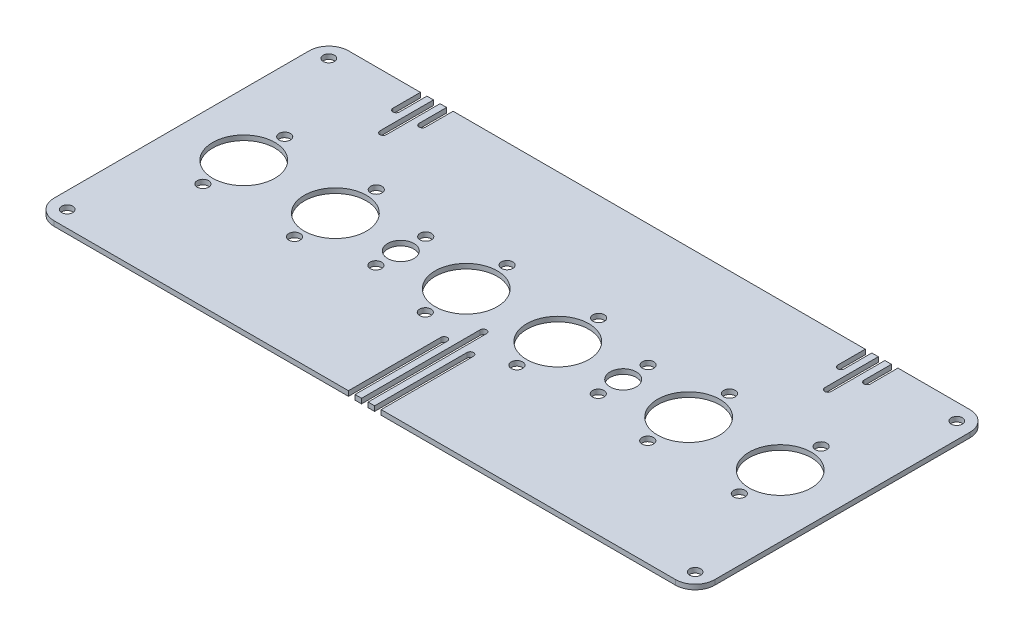
from build123d import *

# Parameters (mm, degrees)
ESQUISSE1_W             = 202
ESQUISSE1_H             = 90
BOSS_EXTRU_1_DEPTH      = 1.5
ENL_V_MAT_EXTRU_1_REACH = 223.148
ESQUISSE2_R             = 9.5
ESQUISSE2_R_2           = 4
ESQUISSE2_R_3           = 1.75
D_GAGEMENT_M31_D        = 3.4
CONG_1_R                = 6
ENL_V_MAT_EXTRU_3_REACH = 223.148


with BuildPart() as part:
    # Esquisse1 → Boss.-Extru.1 (new body)
    with BuildSketch(Plane(origin=(0, 0, 0), x_dir=(1, 0, 0), z_dir=(0, 1, 0))):
        with Locations((101, -45)):
            Rectangle(ESQUISSE1_W, ESQUISSE1_H)
    extrude(amount=BOSS_EXTRU_1_DEPTH)

    # Esquisse2 → Enlèv. mat.-Extru.1 (cut, up to next)
    with BuildSketch(Plane(origin=(0, 1.5, 0), x_dir=(1, 0, 0), z_dir=(0, 1, 0)), mode=Mode.PRIVATE) as enl_v_mat_extru_1_sk1:
        with Locations(Location((115, -45, 0), (0, 0, 270))):
            Circle(ESQUISSE2_R)
    enl_v_mat_extru_1_tool1 = extrude(enl_v_mat_extru_1_sk1.sketch, amount=-ENL_V_MAT_EXTRU_1_REACH, mode=Mode.PRIVATE) & part.part
    # Esquisse2 → Enlèv. mat.-Extru.1 (cut, up to next)
    with BuildSketch(Plane(origin=(0, 1.5, 0), x_dir=(1, 0, 0), z_dir=(0, 1, 0)), mode=Mode.PRIVATE) as enl_v_mat_extru_1_sk2:
        with Locations(Location((87, -45, 0), (0, 0, 270))):
            Circle(ESQUISSE2_R)
    enl_v_mat_extru_1_tool2 = extrude(enl_v_mat_extru_1_sk2.sketch, amount=-ENL_V_MAT_EXTRU_1_REACH, mode=Mode.PRIVATE) & part.part
    # Esquisse2 → Enlèv. mat.-Extru.1 (cut, up to next)
    with BuildSketch(Plane(origin=(0, 1.5, 0), x_dir=(1, 0, 0), z_dir=(0, 1, 0)), mode=Mode.PRIVATE) as enl_v_mat_extru_1_sk3:
        with Locations(Location((155, -45, 0), (0, 0, 270))):
            Circle(ESQUISSE2_R)
    enl_v_mat_extru_1_tool3 = extrude(enl_v_mat_extru_1_sk3.sketch, amount=-ENL_V_MAT_EXTRU_1_REACH, mode=Mode.PRIVATE) & part.part
    # Esquisse2 → Enlèv. mat.-Extru.1 (cut, up to next)
    with BuildSketch(Plane(origin=(0, 1.5, 0), x_dir=(1, 0, 0), z_dir=(0, 1, 0)), mode=Mode.PRIVATE) as enl_v_mat_extru_1_sk4:
        with Locations(Location((183, -45, 0), (0, 0, 270))):
            Circle(ESQUISSE2_R)
    enl_v_mat_extru_1_tool4 = extrude(enl_v_mat_extru_1_sk4.sketch, amount=-ENL_V_MAT_EXTRU_1_REACH, mode=Mode.PRIVATE) & part.part
    # Esquisse2 → Enlèv. mat.-Extru.1 (cut, up to next)
    with BuildSketch(Plane(origin=(0, 1.5, 0), x_dir=(1, 0, 0), z_dir=(0, 1, 0)), mode=Mode.PRIVATE) as enl_v_mat_extru_1_sk5:
        with Locations(Location((47, -45, 0), (0, 0, 270))):
            Circle(ESQUISSE2_R)
    enl_v_mat_extru_1_tool5 = extrude(enl_v_mat_extru_1_sk5.sketch, amount=-ENL_V_MAT_EXTRU_1_REACH, mode=Mode.PRIVATE) & part.part
    # Esquisse2 → Enlèv. mat.-Extru.1 (cut, up to next)
    with BuildSketch(Plane(origin=(0, 1.5, 0), x_dir=(1, 0, 0), z_dir=(0, 1, 0)), mode=Mode.PRIVATE) as enl_v_mat_extru_1_sk6:
        with Locations(Location((19, -45, 0), (0, 0, 270))):
            Circle(ESQUISSE2_R)
    enl_v_mat_extru_1_tool6 = extrude(enl_v_mat_extru_1_sk6.sketch, amount=-ENL_V_MAT_EXTRU_1_REACH, mode=Mode.PRIVATE) & part.part
    # Esquisse2 → Enlèv. mat.-Extru.1 (cut, up to next)
    with BuildSketch(Plane(origin=(0, 1.5, 0), x_dir=(1, 0, 0), z_dir=(0, 1, 0)), mode=Mode.PRIVATE) as enl_v_mat_extru_1_sk7:
        with Locations(Location((67, -45, 0), (0, 0, 270))):
            Circle(ESQUISSE2_R_2)
    enl_v_mat_extru_1_tool7 = extrude(enl_v_mat_extru_1_sk7.sketch, amount=-ENL_V_MAT_EXTRU_1_REACH, mode=Mode.PRIVATE) & part.part
    # Esquisse2 → Enlèv. mat.-Extru.1 (cut, up to next)
    with BuildSketch(Plane(origin=(0, 1.5, 0), x_dir=(1, 0, 0), z_dir=(0, 1, 0)), mode=Mode.PRIVATE) as enl_v_mat_extru_1_sk8:
        with Locations(Location((135, -45, 0), (0, 0, 270))):
            Circle(ESQUISSE2_R_2)
    enl_v_mat_extru_1_tool8 = extrude(enl_v_mat_extru_1_sk8.sketch, amount=-ENL_V_MAT_EXTRU_1_REACH, mode=Mode.PRIVATE) & part.part
    # Esquisse2 → Enlèv. mat.-Extru.1 (cut, up to next)
    with BuildSketch(Plane(origin=(0, 1.5, 0), x_dir=(1, 0, 0), z_dir=(0, 1, 0)), mode=Mode.PRIVATE) as enl_v_mat_extru_1_sk9:
        with Locations(Location((19, -57.5, 0), (0, 0, 270))):
            Circle(ESQUISSE2_R_3)
    enl_v_mat_extru_1_tool9 = extrude(enl_v_mat_extru_1_sk9.sketch, amount=-ENL_V_MAT_EXTRU_1_REACH, mode=Mode.PRIVATE) & part.part
    # Esquisse2 → Enlèv. mat.-Extru.1 (cut, up to next)
    with BuildSketch(Plane(origin=(0, 1.5, 0), x_dir=(1, 0, 0), z_dir=(0, 1, 0)), mode=Mode.PRIVATE) as enl_v_mat_extru_1_sk10:
        with Locations(Location((19, -32.5, 0), (0, 0, 270))):
            Circle(ESQUISSE2_R_3)
    enl_v_mat_extru_1_tool10 = extrude(enl_v_mat_extru_1_sk10.sketch, amount=-ENL_V_MAT_EXTRU_1_REACH, mode=Mode.PRIVATE) & part.part
    # Esquisse2 → Enlèv. mat.-Extru.1 (cut, up to next)
    with BuildSketch(Plane(origin=(0, 1.5, 0), x_dir=(1, 0, 0), z_dir=(0, 1, 0)), mode=Mode.PRIVATE) as enl_v_mat_extru_1_sk11:
        with Locations(Location((47, -57.5, 0), (0, 0, 270))):
            Circle(ESQUISSE2_R_3)
    enl_v_mat_extru_1_tool11 = extrude(enl_v_mat_extru_1_sk11.sketch, amount=-ENL_V_MAT_EXTRU_1_REACH, mode=Mode.PRIVATE) & part.part
    # Esquisse2 → Enlèv. mat.-Extru.1 (cut, up to next)
    with BuildSketch(Plane(origin=(0, 1.5, 0), x_dir=(1, 0, 0), z_dir=(0, 1, 0)), mode=Mode.PRIVATE) as enl_v_mat_extru_1_sk12:
        with Locations(Location((47, -32.5, 0), (0, 0, 270))):
            Circle(ESQUISSE2_R_3)
    enl_v_mat_extru_1_tool12 = extrude(enl_v_mat_extru_1_sk12.sketch, amount=-ENL_V_MAT_EXTRU_1_REACH, mode=Mode.PRIVATE) & part.part
    # Esquisse2 → Enlèv. mat.-Extru.1 (cut, up to next)
    with BuildSketch(Plane(origin=(0, 1.5, 0), x_dir=(1, 0, 0), z_dir=(0, 1, 0)), mode=Mode.PRIVATE) as enl_v_mat_extru_1_sk13:
        with Locations(Location((87, -57.5, 0), (0, 0, 270))):
            Circle(ESQUISSE2_R_3)
    enl_v_mat_extru_1_tool13 = extrude(enl_v_mat_extru_1_sk13.sketch, amount=-ENL_V_MAT_EXTRU_1_REACH, mode=Mode.PRIVATE) & part.part
    # Esquisse2 → Enlèv. mat.-Extru.1 (cut, up to next)
    with BuildSketch(Plane(origin=(0, 1.5, 0), x_dir=(1, 0, 0), z_dir=(0, 1, 0)), mode=Mode.PRIVATE) as enl_v_mat_extru_1_sk14:
        with Locations(Location((87, -32.5, 0), (0, 0, 270))):
            Circle(ESQUISSE2_R_3)
    enl_v_mat_extru_1_tool14 = extrude(enl_v_mat_extru_1_sk14.sketch, amount=-ENL_V_MAT_EXTRU_1_REACH, mode=Mode.PRIVATE) & part.part
    # Esquisse2 → Enlèv. mat.-Extru.1 (cut, up to next)
    with BuildSketch(Plane(origin=(0, 1.5, 0), x_dir=(1, 0, 0), z_dir=(0, 1, 0)), mode=Mode.PRIVATE) as enl_v_mat_extru_1_sk15:
        with Locations(Location((115, -32.5, 0), (0, 0, 270))):
            Circle(ESQUISSE2_R_3)
    enl_v_mat_extru_1_tool15 = extrude(enl_v_mat_extru_1_sk15.sketch, amount=-ENL_V_MAT_EXTRU_1_REACH, mode=Mode.PRIVATE) & part.part
    # Esquisse2 → Enlèv. mat.-Extru.1 (cut, up to next)
    with BuildSketch(Plane(origin=(0, 1.5, 0), x_dir=(1, 0, 0), z_dir=(0, 1, 0)), mode=Mode.PRIVATE) as enl_v_mat_extru_1_sk16:
        with Locations(Location((115, -57.5, 0), (0, 0, 270))):
            Circle(ESQUISSE2_R_3)
    enl_v_mat_extru_1_tool16 = extrude(enl_v_mat_extru_1_sk16.sketch, amount=-ENL_V_MAT_EXTRU_1_REACH, mode=Mode.PRIVATE) & part.part
    # Esquisse2 → Enlèv. mat.-Extru.1 (cut, up to next)
    with BuildSketch(Plane(origin=(0, 1.5, 0), x_dir=(1, 0, 0), z_dir=(0, 1, 0)), mode=Mode.PRIVATE) as enl_v_mat_extru_1_sk17:
        with Locations(Location((155, -57.5, 0), (0, 0, 270))):
            Circle(ESQUISSE2_R_3)
    enl_v_mat_extru_1_tool17 = extrude(enl_v_mat_extru_1_sk17.sketch, amount=-ENL_V_MAT_EXTRU_1_REACH, mode=Mode.PRIVATE) & part.part
    # Esquisse2 → Enlèv. mat.-Extru.1 (cut, up to next)
    with BuildSketch(Plane(origin=(0, 1.5, 0), x_dir=(1, 0, 0), z_dir=(0, 1, 0)), mode=Mode.PRIVATE) as enl_v_mat_extru_1_sk18:
        with Locations(Location((155, -32.5, 0), (0, 0, 270))):
            Circle(ESQUISSE2_R_3)
    enl_v_mat_extru_1_tool18 = extrude(enl_v_mat_extru_1_sk18.sketch, amount=-ENL_V_MAT_EXTRU_1_REACH, mode=Mode.PRIVATE) & part.part
    # Esquisse2 → Enlèv. mat.-Extru.1 (cut, up to next)
    with BuildSketch(Plane(origin=(0, 1.5, 0), x_dir=(1, 0, 0), z_dir=(0, 1, 0)), mode=Mode.PRIVATE) as enl_v_mat_extru_1_sk19:
        with Locations(Location((183, -32.5, 0), (0, 0, 270))):
            Circle(ESQUISSE2_R_3)
    enl_v_mat_extru_1_tool19 = extrude(enl_v_mat_extru_1_sk19.sketch, amount=-ENL_V_MAT_EXTRU_1_REACH, mode=Mode.PRIVATE) & part.part
    # Esquisse2 → Enlèv. mat.-Extru.1 (cut, up to next)
    with BuildSketch(Plane(origin=(0, 1.5, 0), x_dir=(1, 0, 0), z_dir=(0, 1, 0)), mode=Mode.PRIVATE) as enl_v_mat_extru_1_sk20:
        with Locations(Location((183, -57.5, 0), (0, 0, 270))):
            Circle(ESQUISSE2_R_3)
    enl_v_mat_extru_1_tool20 = extrude(enl_v_mat_extru_1_sk20.sketch, amount=-ENL_V_MAT_EXTRU_1_REACH, mode=Mode.PRIVATE) & part.part
    # Esquisse2 → Enlèv. mat.-Extru.1 (cut, up to next)
    with BuildSketch(Plane(origin=(0, 1.5, 0), x_dir=(1, 0, 0), z_dir=(0, 1, 0)), mode=Mode.PRIVATE) as enl_v_mat_extru_1_sk21:
        with Locations(Location((67, -52.62, 0), (0, 0, 270))):
            Circle(ESQUISSE2_R_3)
    enl_v_mat_extru_1_tool21 = extrude(enl_v_mat_extru_1_sk21.sketch, amount=-ENL_V_MAT_EXTRU_1_REACH, mode=Mode.PRIVATE) & part.part
    # Esquisse2 → Enlèv. mat.-Extru.1 (cut, up to next)
    with BuildSketch(Plane(origin=(0, 1.5, 0), x_dir=(1, 0, 0), z_dir=(0, 1, 0)), mode=Mode.PRIVATE) as enl_v_mat_extru_1_sk22:
        with Locations(Location((67, -37.38, 0), (0, 0, 270))):
            Circle(ESQUISSE2_R_3)
    enl_v_mat_extru_1_tool22 = extrude(enl_v_mat_extru_1_sk22.sketch, amount=-ENL_V_MAT_EXTRU_1_REACH, mode=Mode.PRIVATE) & part.part
    # Esquisse2 → Enlèv. mat.-Extru.1 (cut, up to next)
    with BuildSketch(Plane(origin=(0, 1.5, 0), x_dir=(1, 0, 0), z_dir=(0, 1, 0)), mode=Mode.PRIVATE) as enl_v_mat_extru_1_sk23:
        with Locations(Location((135, -37.38, 0), (0, 0, 270))):
            Circle(ESQUISSE2_R_3)
    enl_v_mat_extru_1_tool23 = extrude(enl_v_mat_extru_1_sk23.sketch, amount=-ENL_V_MAT_EXTRU_1_REACH, mode=Mode.PRIVATE) & part.part
    # Esquisse2 → Enlèv. mat.-Extru.1 (cut, up to next)
    with BuildSketch(Plane(origin=(0, 1.5, 0), x_dir=(1, 0, 0), z_dir=(0, 1, 0)), mode=Mode.PRIVATE) as enl_v_mat_extru_1_sk24:
        with Locations(Location((135, -52.62, 0), (0, 0, 270))):
            Circle(ESQUISSE2_R_3)
    enl_v_mat_extru_1_tool24 = extrude(enl_v_mat_extru_1_sk24.sketch, amount=-ENL_V_MAT_EXTRU_1_REACH, mode=Mode.PRIVATE) & part.part
    add(enl_v_mat_extru_1_tool1.solids().sort_by_distance((115, 1.5, 45))[0], mode=Mode.SUBTRACT)
    add(enl_v_mat_extru_1_tool2.solids().sort_by_distance((87, 1.5, 45))[0], mode=Mode.SUBTRACT)
    add(enl_v_mat_extru_1_tool3.solids().sort_by_distance((155, 1.5, 45))[0], mode=Mode.SUBTRACT)
    add(enl_v_mat_extru_1_tool4.solids().sort_by_distance((183, 1.5, 45))[0], mode=Mode.SUBTRACT)
    add(enl_v_mat_extru_1_tool5.solids().sort_by_distance((47, 1.5, 45))[0], mode=Mode.SUBTRACT)
    add(enl_v_mat_extru_1_tool6.solids().sort_by_distance((19, 1.5, 45))[0], mode=Mode.SUBTRACT)
    add(enl_v_mat_extru_1_tool7.solids().sort_by_distance((67, 1.5, 45))[0], mode=Mode.SUBTRACT)
    add(enl_v_mat_extru_1_tool8.solids().sort_by_distance((135, 1.5, 45))[0], mode=Mode.SUBTRACT)
    add(enl_v_mat_extru_1_tool9.solids().sort_by_distance((19, 1.5, 57.5))[0], mode=Mode.SUBTRACT)
    add(enl_v_mat_extru_1_tool10.solids().sort_by_distance((19, 1.5, 32.5))[0], mode=Mode.SUBTRACT)
    add(enl_v_mat_extru_1_tool11.solids().sort_by_distance((47, 1.5, 57.5))[0], mode=Mode.SUBTRACT)
    add(enl_v_mat_extru_1_tool12.solids().sort_by_distance((47, 1.5, 32.5))[0], mode=Mode.SUBTRACT)
    add(enl_v_mat_extru_1_tool13.solids().sort_by_distance((87, 1.5, 57.5))[0], mode=Mode.SUBTRACT)
    add(enl_v_mat_extru_1_tool14.solids().sort_by_distance((87, 1.5, 32.5))[0], mode=Mode.SUBTRACT)
    add(enl_v_mat_extru_1_tool15.solids().sort_by_distance((115, 1.5, 32.5))[0], mode=Mode.SUBTRACT)
    add(enl_v_mat_extru_1_tool16.solids().sort_by_distance((115, 1.5, 57.5))[0], mode=Mode.SUBTRACT)
    add(enl_v_mat_extru_1_tool17.solids().sort_by_distance((155, 1.5, 57.5))[0], mode=Mode.SUBTRACT)
    add(enl_v_mat_extru_1_tool18.solids().sort_by_distance((155, 1.5, 32.5))[0], mode=Mode.SUBTRACT)
    add(enl_v_mat_extru_1_tool19.solids().sort_by_distance((183, 1.5, 32.5))[0], mode=Mode.SUBTRACT)
    add(enl_v_mat_extru_1_tool20.solids().sort_by_distance((183, 1.5, 57.5))[0], mode=Mode.SUBTRACT)
    add(enl_v_mat_extru_1_tool21.solids().sort_by_distance((67, 1.5, 52.62))[0], mode=Mode.SUBTRACT)
    add(enl_v_mat_extru_1_tool22.solids().sort_by_distance((67, 1.5, 37.38))[0], mode=Mode.SUBTRACT)
    add(enl_v_mat_extru_1_tool23.solids().sort_by_distance((135, 1.5, 37.38))[0], mode=Mode.SUBTRACT)
    add(enl_v_mat_extru_1_tool24.solids().sort_by_distance((135, 1.5, 52.62))[0], mode=Mode.SUBTRACT)

    # Dégagement M31 (through all)
    with Locations(Plane(origin=(0, 0, 0), x_dir=(-1, 0, 0), z_dir=(0, -1, 0))):
        with Locations((-5, -85), (-5, -5), (-197, -5), (-197, -85)):
            Hole(D_GAGEMENT_M31_D / 2)

    # Congé1
    cong_1_edges = [part.edges().sort_by_distance(p)[0] for p in [
        (0, 0.75, 0),
        (202, 0.75, 0),
        (202, 0.75, 90),
        (0, 0.75, 90),
    ]]
    fillet(cong_1_edges, radius=CONG_1_R)

    # Esquisse6 → Enlèv. mat.-Extru.3 (cut, up to next)
    with BuildSketch(Plane(origin=(0, 1.5, 0), x_dir=(1, 0, 0), z_dir=(0, 1, 0)), mode=Mode.PRIVATE) as enl_v_mat_extru_3_sk1:
        with BuildLine():
            Line((100, -90), (102, -90))
            Line((102, -90), (102, -53.763853049))
            ThreePointArc((102, -53.763853049), (101, -52.763853049), (100, -53.763853049))
            Line((100, -53.763853049), (100, -90))
        make_face()
    enl_v_mat_extru_3_tool1 = extrude(enl_v_mat_extru_3_sk1.sketch, amount=-ENL_V_MAT_EXTRU_3_REACH, mode=Mode.PRIVATE) & part.part
    # Esquisse6 → Enlèv. mat.-Extru.3 (cut, up to next)
    with BuildSketch(Plane(origin=(0, 1.5, 0), x_dir=(1, 0, 0), z_dir=(0, 1, 0)), mode=Mode.PRIVATE) as enl_v_mat_extru_3_sk2:
        with BuildLine():
            Line((96, -61.763853049), (96, -90))
            Line((96, -90), (98, -90))
            Line((98, -90), (98, -61.763853049))
            ThreePointArc((98, -61.763853049), (97, -60.763853049), (96, -61.763853049))
        make_face()
    enl_v_mat_extru_3_tool2 = extrude(enl_v_mat_extru_3_sk2.sketch, amount=-ENL_V_MAT_EXTRU_3_REACH, mode=Mode.PRIVATE) & part.part
    # Esquisse6 → Enlèv. mat.-Extru.3 (cut, up to next)
    with BuildSketch(Plane(origin=(0, 1.5, 0), x_dir=(1, 0, 0), z_dir=(0, 1, 0)), mode=Mode.PRIVATE) as enl_v_mat_extru_3_sk3:
        with BuildLine():
            Line((104, -61.763853049), (104, -90))
            Line((104, -90), (106, -90))
            Line((106, -90), (106, -61.763853049))
            ThreePointArc((106, -61.763853049), (105, -60.763853049), (104, -61.763853049))
        make_face()
    enl_v_mat_extru_3_tool3 = extrude(enl_v_mat_extru_3_sk3.sketch, amount=-ENL_V_MAT_EXTRU_3_REACH, mode=Mode.PRIVATE) & part.part
    # Esquisse6 → Enlèv. mat.-Extru.3 (cut, up to next)
    with BuildSketch(Plane(origin=(0, 1.5, 0), x_dir=(1, 0, 0), z_dir=(0, 1, 0)), mode=Mode.PRIVATE) as enl_v_mat_extru_3_sk4:
        with BuildLine():
            Line((32, 0), (34, 0))
            Line((34, 0), (34, -16.412224746))
            ThreePointArc((34, -16.412224746), (33, -17.412224746), (32, -16.412224746))
            Line((32, -16.412224746), (32, 0))
        make_face()
    enl_v_mat_extru_3_tool4 = extrude(enl_v_mat_extru_3_sk4.sketch, amount=-ENL_V_MAT_EXTRU_3_REACH, mode=Mode.PRIVATE) & part.part
    # Esquisse6 → Enlèv. mat.-Extru.3 (cut, up to next)
    with BuildSketch(Plane(origin=(0, 1.5, 0), x_dir=(1, 0, 0), z_dir=(0, 1, 0)), mode=Mode.PRIVATE) as enl_v_mat_extru_3_sk5:
        with BuildLine():
            Line((36, 0), (38, 0))
            Line((38, 0), (38, -8.412224746))
            ThreePointArc((38, -8.412224746), (37, -9.412224746), (36, -8.412224746))
            Line((36, -8.412224746), (36, 0))
        make_face()
    enl_v_mat_extru_3_tool5 = extrude(enl_v_mat_extru_3_sk5.sketch, amount=-ENL_V_MAT_EXTRU_3_REACH, mode=Mode.PRIVATE) & part.part
    # Esquisse6 → Enlèv. mat.-Extru.3 (cut, up to next)
    with BuildSketch(Plane(origin=(0, 1.5, 0), x_dir=(1, 0, 0), z_dir=(0, 1, 0)), mode=Mode.PRIVATE) as enl_v_mat_extru_3_sk6:
        with BuildLine():
            Line((28, 0), (30, 0))
            Line((30, 0), (30, -8.412224746))
            ThreePointArc((30, -8.412224746), (29, -9.412224746), (28, -8.412224746))
            Line((28, -8.412224746), (28, 0))
        make_face()
    enl_v_mat_extru_3_tool6 = extrude(enl_v_mat_extru_3_sk6.sketch, amount=-ENL_V_MAT_EXTRU_3_REACH, mode=Mode.PRIVATE) & part.part
    # Esquisse6 → Enlèv. mat.-Extru.3 (cut, up to next)
    with BuildSketch(Plane(origin=(0, 1.5, 0), x_dir=(1, 0, 0), z_dir=(0, 1, 0)), mode=Mode.PRIVATE) as enl_v_mat_extru_3_sk7:
        with BuildLine():
            Line((168, 0), (170, 0))
            Line((170, 0), (170, -16.412224746))
            ThreePointArc((170, -16.412224746), (169, -17.412224746), (168, -16.412224746))
            Line((168, -16.412224746), (168, 0))
        make_face()
    enl_v_mat_extru_3_tool7 = extrude(enl_v_mat_extru_3_sk7.sketch, amount=-ENL_V_MAT_EXTRU_3_REACH, mode=Mode.PRIVATE) & part.part
    # Esquisse6 → Enlèv. mat.-Extru.3 (cut, up to next)
    with BuildSketch(Plane(origin=(0, 1.5, 0), x_dir=(1, 0, 0), z_dir=(0, 1, 0)), mode=Mode.PRIVATE) as enl_v_mat_extru_3_sk8:
        with BuildLine():
            Line((172, 0), (174, 0))
            Line((174, 0), (174, -8.412224746))
            ThreePointArc((174, -8.412224746), (173, -9.412224746), (172, -8.412224746))
            Line((172, -8.412224746), (172, 0))
        make_face()
    enl_v_mat_extru_3_tool8 = extrude(enl_v_mat_extru_3_sk8.sketch, amount=-ENL_V_MAT_EXTRU_3_REACH, mode=Mode.PRIVATE) & part.part
    # Esquisse6 → Enlèv. mat.-Extru.3 (cut, up to next)
    with BuildSketch(Plane(origin=(0, 1.5, 0), x_dir=(1, 0, 0), z_dir=(0, 1, 0)), mode=Mode.PRIVATE) as enl_v_mat_extru_3_sk9:
        with BuildLine():
            Line((164, 0), (166, 0))
            Line((166, 0), (166, -8.412224746))
            ThreePointArc((166, -8.412224746), (165, -9.412224746), (164, -8.412224746))
            Line((164, -8.412224746), (164, 0))
        make_face()
    enl_v_mat_extru_3_tool9 = extrude(enl_v_mat_extru_3_sk9.sketch, amount=-ENL_V_MAT_EXTRU_3_REACH, mode=Mode.PRIVATE) & part.part
    add(enl_v_mat_extru_3_tool1.solids().sort_by_distance((101, 1.5, 71.488555))[0], mode=Mode.SUBTRACT)
    add(enl_v_mat_extru_3_tool2.solids().sort_by_distance((97, 1.5, 75.488369))[0], mode=Mode.SUBTRACT)
    add(enl_v_mat_extru_3_tool3.solids().sort_by_distance((105, 1.5, 75.488369))[0], mode=Mode.SUBTRACT)
    add(enl_v_mat_extru_3_tool4.solids().sort_by_distance((33, 1.5, 8.60026))[0], mode=Mode.SUBTRACT)
    add(enl_v_mat_extru_3_tool5.solids().sort_by_distance((37, 1.5, 4.60152))[0], mode=Mode.SUBTRACT)
    add(enl_v_mat_extru_3_tool6.solids().sort_by_distance((29, 1.5, 4.60152))[0], mode=Mode.SUBTRACT)
    add(enl_v_mat_extru_3_tool7.solids().sort_by_distance((169, 1.5, 8.60026))[0], mode=Mode.SUBTRACT)
    add(enl_v_mat_extru_3_tool8.solids().sort_by_distance((173, 1.5, 4.60152))[0], mode=Mode.SUBTRACT)
    add(enl_v_mat_extru_3_tool9.solids().sort_by_distance((165, 1.5, 4.60152))[0], mode=Mode.SUBTRACT)


solid = part.part
